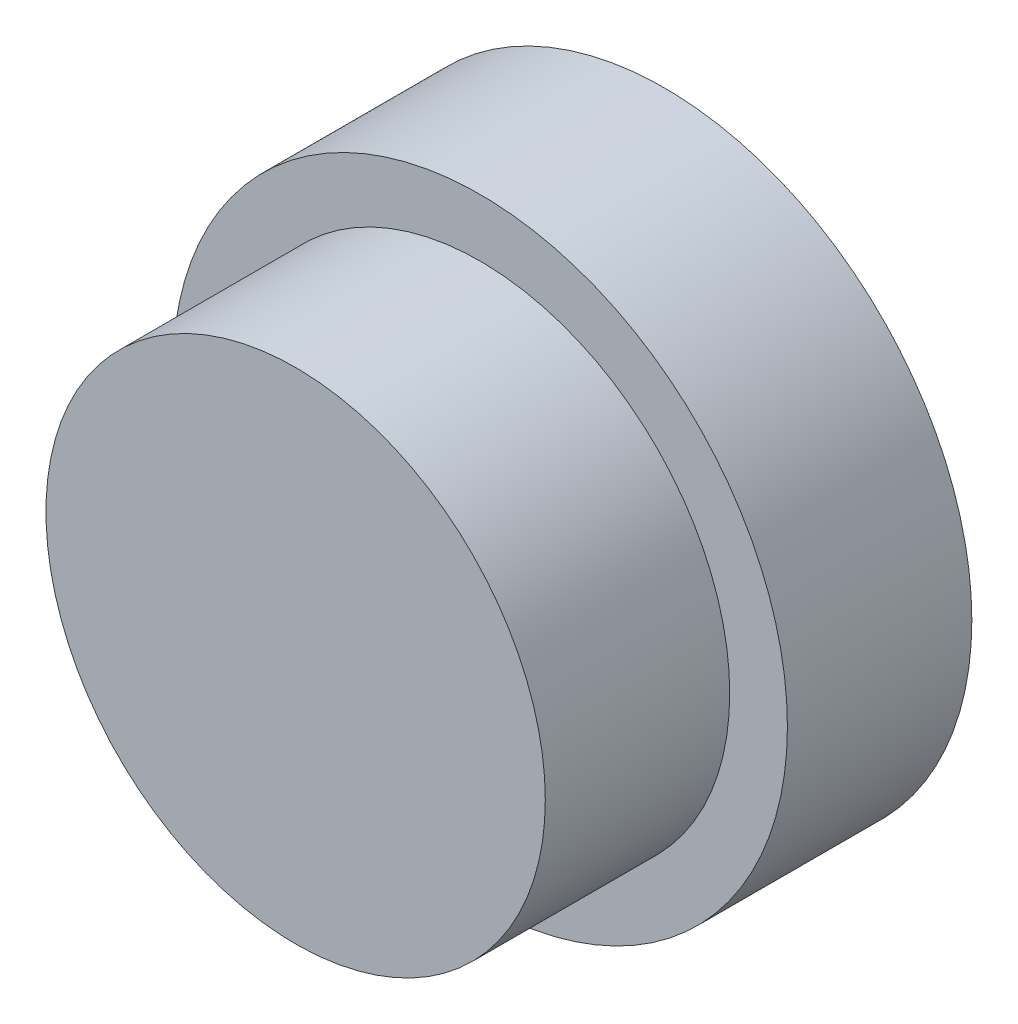
from build123d import *

# Parameters (mm, degrees)
SKETCH1_R           = 5
BOSS_EXTRUDE1_DEPTH = 3
SKETCH2_R           = 4.061365787
BOSS_EXTRUDE2_DEPTH = 3


with BuildPart() as part:
    # Sketch1 → Boss-Extrude1 (new body)
    with BuildSketch(Plane.XY):
        Circle(SKETCH1_R)
    extrude(amount=BOSS_EXTRUDE1_DEPTH)

    # Sketch2 → Boss-Extrude2 (add)
    with BuildSketch(Plane.XY.offset(3)):
        Circle(SKETCH2_R)
    extrude(amount=BOSS_EXTRUDE2_DEPTH)


solid = part.part
